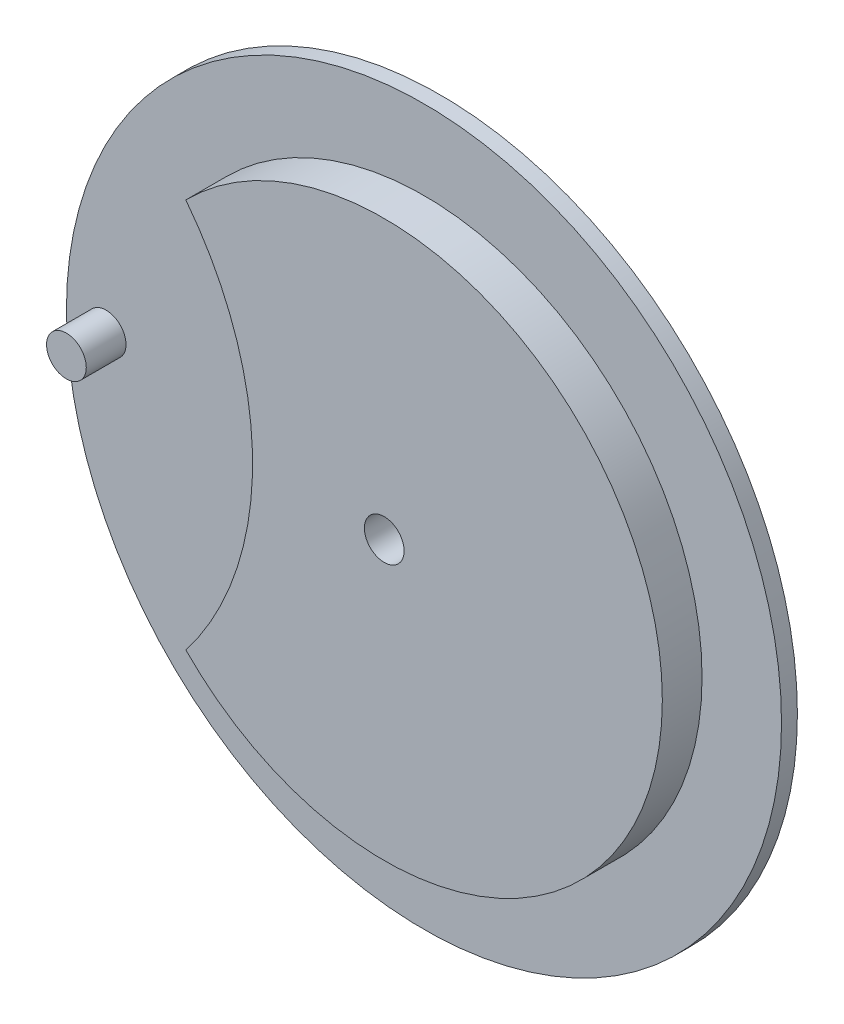
from build123d import *

# Parameters (mm, degrees)
SKETCH_1_R      = 3.5775
SKETCH_1_R_2    = 0.19875
EXTRUDE_2_DEPTH = 0.159
EXTRUDE_START   = 0.3975
SKETCH_1_6_R    = 0.19875
EXTRUDE_3_DEPTH = 0.3975


with BuildPart() as part:
    # 草图1 → 凸台-拉伸2 (new body)
    with BuildSketch(Plane.XY):
        Circle(SKETCH_1_R)
        Circle(SKETCH_1_R_2, mode=Mode.SUBTRACT)
    extrude(amount=-EXTRUDE_2_DEPTH)

    # 草图1<6> → 凸台-拉伸3 (add)
    # profile 1 of 2: a face of its own
    with BuildSketch(Plane.XY.offset(EXTRUDE_START)):
        with BuildLine():
            ThreePointArc((-1.985091803, 1.949799165), (-1.317199128, 0), (-1.985091803, -1.949799165))
            ThreePointArc((-1.985091803, -1.949799165), (2.7825, 0), (-1.985091803, 1.949799165))
        make_face()
        Circle(SKETCH_1_6_R, mode=Mode.SUBTRACT)
    # profile 2 of 2: a face of its own
    with BuildSketch(Plane.XY.offset(EXTRUDE_START)):
        with Locations((-3.18, 0)):
            Circle(SKETCH_1_6_R)
    extrude(amount=-EXTRUDE_3_DEPTH)


solid = part.part
